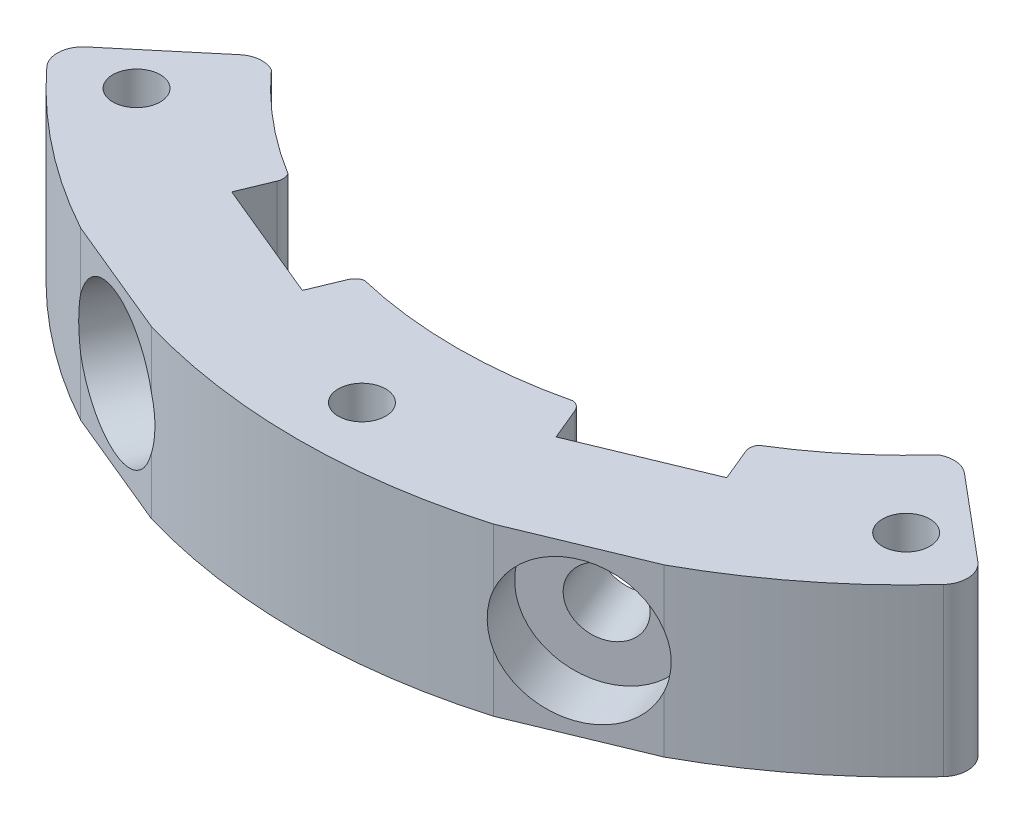
from build123d import *

# Parameters (mm, degrees)
SKETCH_1_R          = 1.85
EXTRUDE_1_DEPTH     = 13
SKETCH_2_R          = 2.6
CUT_EXTRUDE_1_DEPTH = 10
SKETCH_3_R          = 2.6
CUT_EXTRUDE_2_DEPTH = 10
FILLET_1_R          = 2
FILLET_2_R          = 1
SKETCH_4_R          = 3.5
SKETCH_4_R_2        = 1.85
CUT_EXTRUDE_3_DEPTH = 7
CUT_EXTRUDE_5_DEPTH = 61.729236251
CUT_EXTRUDE_START   = -4
SKETCH_6_R          = 5.5
SKETCH_6_R_2        = 2.6
CUT_EXTRUDE_6_DEPTH = 4
SKETCH_7_R          = 5.5
SKETCH_7_R_2        = 2.6
CUT_EXTRUDE_7_DEPTH = 4
SKETCH_8_R          = 35.1
CUT_EXTRUDE_8_DEPTH = 61.729236251


with BuildPart() as part:
    # 草图1 → 凸台-拉伸1 (new body)
    with BuildSketch(Plane(origin=(0, 0, 0), x_dir=(1, 0, 0), z_dir=(0, 1, 0))):
        with BuildLine():
            ThreePointArc((-17.962748608, -30.038969064), (-22.702483698, -26.638266346), (-26.811555509, -22.497566339))
            Line((-26.811555509, -22.497566339), (-36.387111048, -30.53241146))
            ThreePointArc((-36.387111048, -30.53241146), (0, -47.5), (36.387111048, -30.53241146))
            Line((36.387111048, -30.53241146), (26.811555509, -22.497566339))
            ThreePointArc((26.811555509, -22.497566339), (22.702483698, -26.638266346), (17.962748608, -30.038969064))
            Line((17.962748608, -30.038969064), (19.330292732, -33.340512637))
            Line((19.330292732, -33.340512637), (9.906721501, -37.243883647))
            Line((9.906721501, -37.243883647), (8.539177376, -33.942340075))
            ThreePointArc((8.539177376, -33.942340075), (0, -35), (-8.539177376, -33.942340075))
            Line((-8.539177376, -33.942340075), (-9.906721501, -37.243883647))
            Line((-9.906721501, -37.243883647), (-19.330292732, -33.340512637))
            Line((-19.330292732, -33.340512637), (-17.962748608, -30.038969064))
        make_face()
        with BuildLine():
            ThreePointArc((-28.2020382, -30.0520382), (-28.237585432, -30.412955296), (-28.342861065, -30.76000255))
            ThreePointArc((-28.342861065, -30.76000255), (-31.866490969, -29.691121105), (-28.2020382, -30.0520382))
        make_face(mode=Mode.SUBTRACT)
        with BuildLine():
            ThreePointArc((1.85, -42.5), (-0.360917096, -44.314452769), (-1.709177135, -41.79203565))
            ThreePointArc((-1.709177135, -41.79203565), (0.360917096, -40.685547231), (1.85, -42.5))
        make_face(mode=Mode.SUBTRACT)
        with Locations(Location((30.0520382, -30.0520382, 0), (0, 0, 90))):
            Circle(SKETCH_1_R, mode=Mode.SUBTRACT)
    extrude(amount=EXTRUDE_1_DEPTH)

    # 草图2 → 切除-拉伸1 (cut)
    with BuildSketch(Plane(origin=(-14.618507116, 0, 35.292198142), x_dir=(-0.9238795325112864, 0, -0.38268343236509067), z_dir=(0.38268343236509067, 0, -0.9238795325112864))):
        with Locations((0, 6.5)):
            Circle(SKETCH_2_R)
    extrude(amount=-CUT_EXTRUDE_1_DEPTH, mode=Mode.SUBTRACT)

    # 草图3 → 切除-拉伸2 (cut)
    with BuildSketch(Plane(origin=(14.618507116, 0, 35.292198142), x_dir=(-0.9238795325112864, 0, 0.38268343236509067), z_dir=(-0.38268343236509067, 0, -0.9238795325112864))):
        with Locations((0, 6.5)):
            Circle(SKETCH_3_R)
    extrude(amount=-CUT_EXTRUDE_2_DEPTH, mode=Mode.SUBTRACT)

    # 圆角1
    fillet_1_edges = [part.edges().sort_by_distance(p)[0] for p in [
        (-26.811555509, 6.5, 22.497566339),
        (26.811555509, 6.5, 22.497566339),
        (36.387111048, 6.5, 30.53241146),
        (-36.387111048, 6.5, 30.53241146),
    ]]
    fillet(fillet_1_edges, radius=FILLET_1_R)

    # 圆角2
    fillet_2_edges = [part.edges().sort_by_distance(p)[0] for p in [
        (-17.962748608, 6.5, 30.038969064),
        (-8.539177376, 6.5, 33.942340075),
        (8.539177376, 6.5, 33.942340075),
        (17.962748608, 6.5, 30.038969064),
    ]]
    fillet(fillet_2_edges, radius=FILLET_2_R)

    # 草图4 → 切除-拉伸3 (cut)
    # profile 1 of 3: a face of its own
    with BuildSketch(Plane.XZ):
        with Locations(Location((-30.0520382, 30.0520382, 0), (0, 0, 270))):
            Circle(SKETCH_4_R)
        with Locations(Location((-30.0520382, 30.0520382, 0), (0, 0, 270))):
            Circle(SKETCH_4_R_2, mode=Mode.SUBTRACT)
    # profile 2 of 3: a face of its own
    with BuildSketch(Plane.XZ):
        with Locations(Location((0, 42.5, 0), (0, 0, 270))):
            Circle(SKETCH_4_R)
        with Locations(Location((0, 42.5, 0), (0, 0, 270))):
            Circle(SKETCH_4_R_2, mode=Mode.SUBTRACT)
    # profile 3 of 3: a face of its own
    with BuildSketch(Plane.XZ):
        with Locations(Location((30.0520382, 30.0520382, 0), (0, 0, 270))):
            Circle(SKETCH_4_R)
        with Locations(Location((30.0520382, 30.0520382, 0), (0, 0, 270))):
            Circle(SKETCH_4_R_2, mode=Mode.SUBTRACT)
    extrude(amount=-CUT_EXTRUDE_3_DEPTH, mode=Mode.SUBTRACT)

    # 草图5 → 切除-拉伸5 (cut, through all)
    with BuildSketch(Plane.XZ):
        with BuildLine():
            Line((-22.784170244, 41.67891057), (-18.072384629, 43.630596075))
            Line((-18.072384629, 43.630596075), (-18.177463037, 43.884277794))
            ThreePointArc((-18.177463037, 43.884277794), (-20.510479308, 42.843555391), (-22.784170244, 41.67891057))
        make_face()
        with BuildLine():
            Line((-18.177463037, 43.884277794), (-18.072384629, 43.630596075))
            Line((-18.072384629, 43.630596075), (-13.360599013, 45.58228158))
            ThreePointArc((-13.360599013, 45.58228158), (-15.791869544, 44.798067551), (-18.177463037, 43.884277794))
        make_face()
        with BuildLine():
            ThreePointArc((18.177463037, 43.884277794), (15.791869544, 44.798067551), (13.360599013, 45.58228158))
            Line((13.360599013, 45.58228158), (18.072384629, 43.630596075))
            Line((18.072384629, 43.630596075), (18.177463037, 43.884277794))
        make_face()
        with BuildLine():
            Line((18.177463037, 43.884277794), (18.072384629, 43.630596075))
            Line((18.072384629, 43.630596075), (22.784170244, 41.67891057))
            ThreePointArc((22.784170244, 41.67891057), (20.510479308, 42.843555391), (18.177463037, 43.884277794))
        make_face()
    extrude(amount=-CUT_EXTRUDE_5_DEPTH, mode=Mode.SUBTRACT)

    # 草图6 → 切除-拉伸6 (cut)
    with BuildSketch(Plane(origin=(-18.072384629, 0, 43.630596075), x_dir=(0.9238795325112865, 0, 0.38268343236509045), z_dir=(-0.38268343236509045, 0, 0.9238795325112865)).offset(CUT_EXTRUDE_START)):
        with Locations((0, 6.5)):
            Circle(SKETCH_6_R)
        with Locations(Location((0, 6.5, 0), (0, 0, 180))):
            Circle(SKETCH_6_R_2, mode=Mode.SUBTRACT)
    extrude(amount=CUT_EXTRUDE_6_DEPTH, mode=Mode.SUBTRACT)

    # 草图7 → 切除-拉伸7 (cut)
    with BuildSketch(Plane(origin=(18.072384629, 0, 43.630596075), x_dir=(0.9238795325112865, 0, -0.38268343236509045), z_dir=(0.38268343236509045, 0, 0.9238795325112865)).offset(CUT_EXTRUDE_START)):
        with Locations((0, 6.5)):
            Circle(SKETCH_7_R)
        with Locations(Location((0, 6.5, 0), (0, 0, 180))):
            Circle(SKETCH_7_R_2, mode=Mode.SUBTRACT)
    extrude(amount=CUT_EXTRUDE_7_DEPTH, mode=Mode.SUBTRACT)

    # 草图8 → 切除-拉伸8 (cut, through all)
    with BuildSketch(Plane(origin=(0, 13, 0), x_dir=(1, 0, 0), z_dir=(0, 1, 0))):
        Circle(SKETCH_8_R)
    extrude(amount=-CUT_EXTRUDE_8_DEPTH, mode=Mode.SUBTRACT)


solid = part.part
